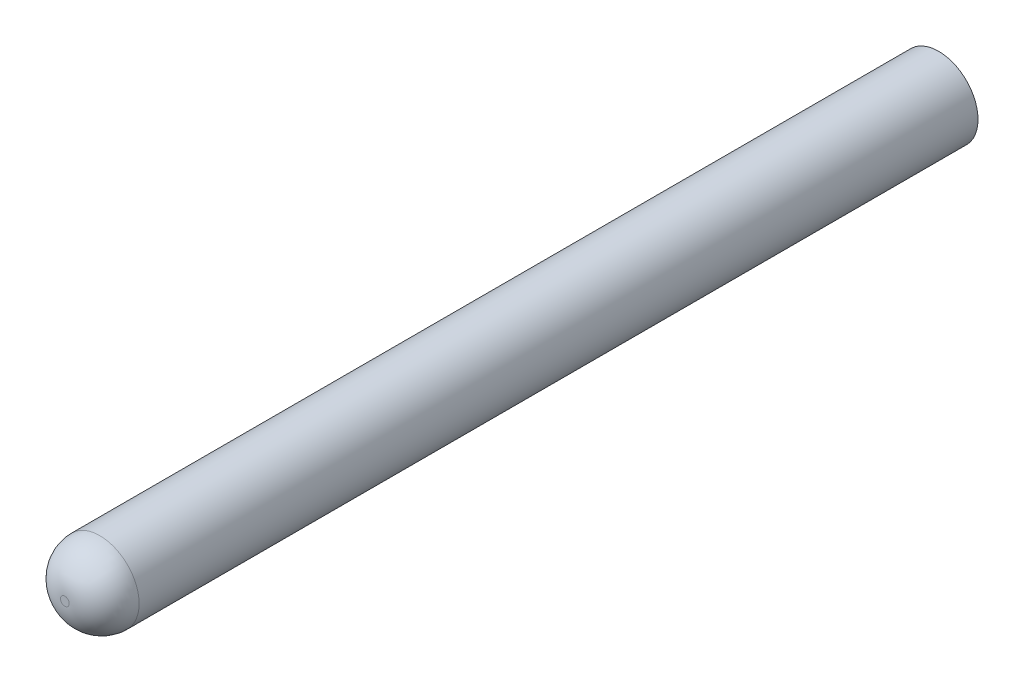
from build123d import *

# Parameters (mm, degrees)
SKETCH_1_R      = 4.5
EXTRUDE_1_DEPTH = 100
FILLET_3_R      = 4


with BuildPart() as part:
    # 草图1 → 凸台-拉伸1 (new body)
    with BuildSketch(Plane.XY):
        Circle(SKETCH_1_R)
    extrude(amount=EXTRUDE_1_DEPTH)

    # 圆角3
    fillet_3_edges = [part.edges().sort_by_distance(p)[0] for p in [
        (-4.5, 0, 100),
    ]]
    fillet(fillet_3_edges, radius=FILLET_3_R)


solid = part.part
